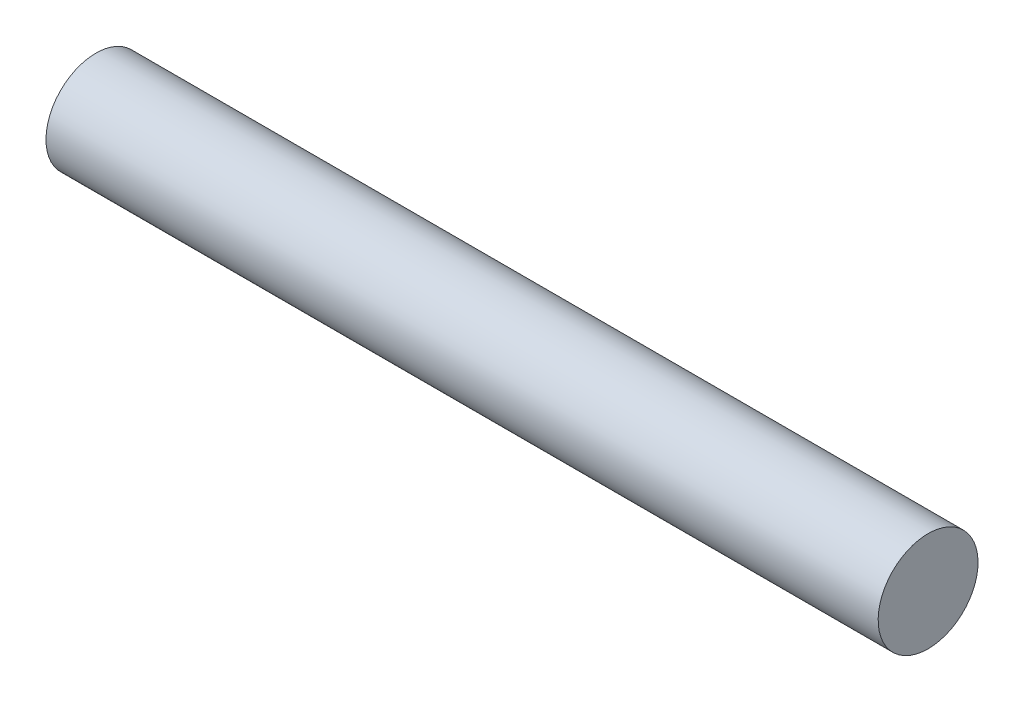
from build123d import *

# Parameters (mm, degrees)
SKETCH1_W = 200
SKETCH1_H = 12


with BuildPart() as part:
    # Sketch1 → Revolve1 (revolve)
    with BuildSketch(Plane.XY):
        with Locations((-38.493816224, 2.448979592)):
            Rectangle(SKETCH1_W, SKETCH1_H)
    revolve(axis=Axis((-138.493816224, 8.448979592, 0), (1, 0, 0)))


solid = part.part
